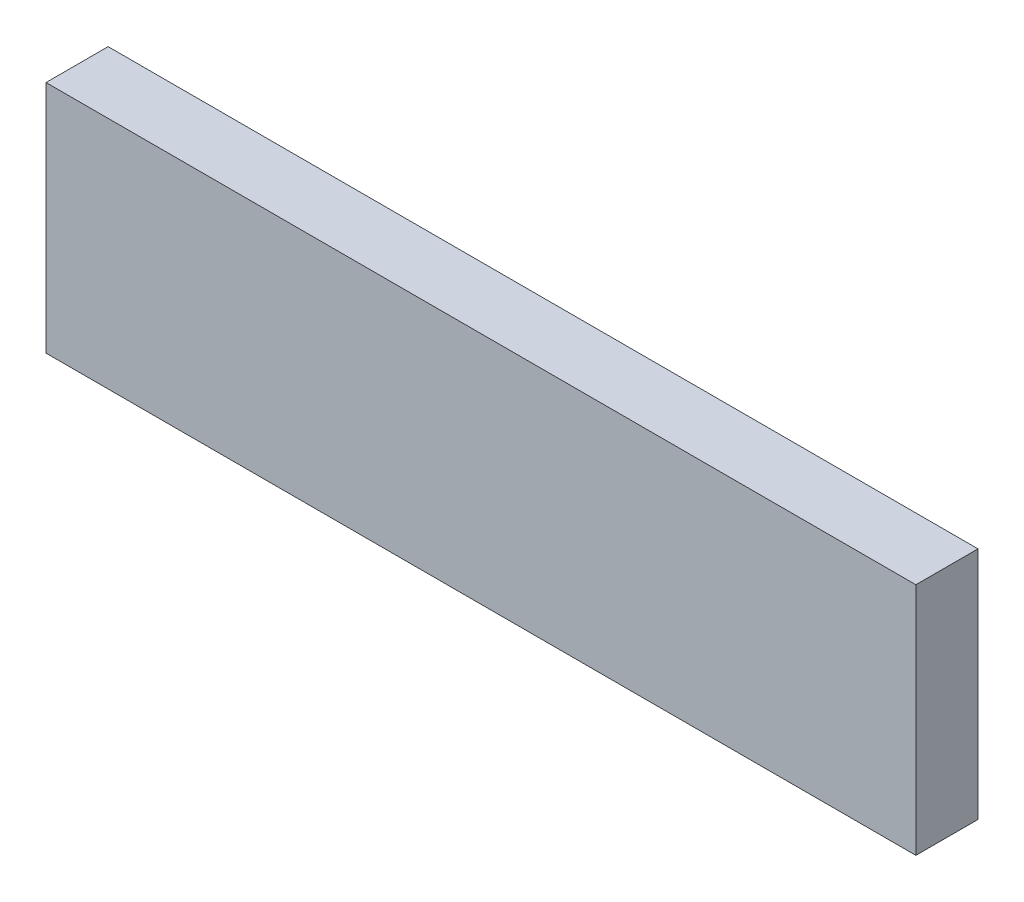
from build123d import *

# Parameters (mm, degrees)
CROQUIS1_W              = 70
CROQUIS1_H              = 18.861152416
SALIENTE_EXTRUIR1_DEPTH = 5


with BuildPart() as part:
    # Croquis1 → Saliente-Extruir1 (new body)
    with BuildSketch(Plane.XY):
        with Locations((35, 9.430576208)):
            Rectangle(CROQUIS1_W, CROQUIS1_H)
    extrude(amount=SALIENTE_EXTRUIR1_DEPTH)


solid = part.part
